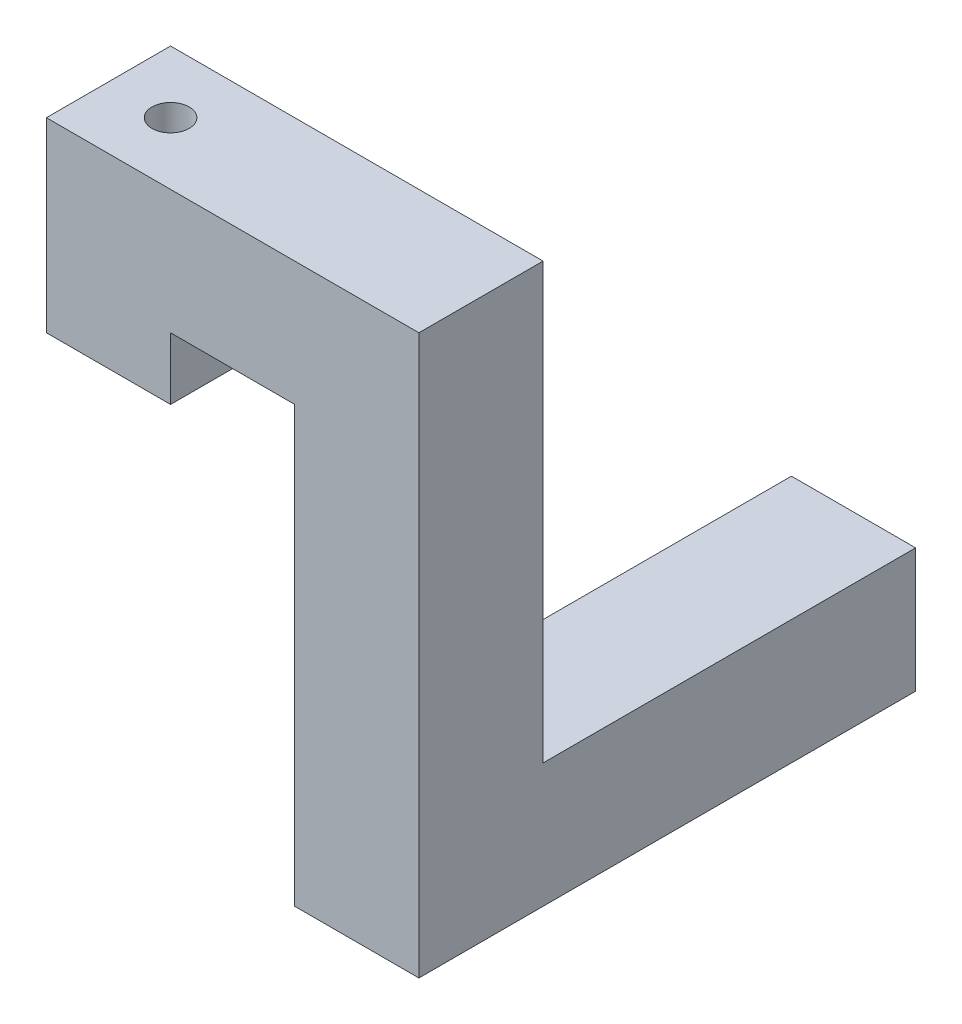
from build123d import *

# Parameters (mm, degrees)
SKETCH_1_W          = 20
SKETCH_1_H          = 20
EXTRUDE_1_DEPTH     = 30
SKETCH_2_W          = 20
SKETCH_2_H          = 20
EXTRUDE_2_DEPTH     = 40
SKETCH_6_W          = 20
SKETCH_6_H          = 20
EXTRUDE_3_DEPTH     = 70
SKETCH_7_W          = 20
SKETCH_7_H          = 20
EXTRUDE_4_DEPTH     = 60
SKETCH_8_R          = 3
CUT_EXTRUDE_1_DEPTH = 60


with BuildPart() as part:
    # 草图1 → 凸台-拉伸1 (new body)
    with BuildSketch(Plane(origin=(0, 0, 0), x_dir=(1, 0, 0), z_dir=(0, 1, 0))):
        Rectangle(SKETCH_1_W, SKETCH_1_H)
    extrude(amount=EXTRUDE_1_DEPTH)

    # 草图2 → 凸台-拉伸2 (add)
    with BuildSketch(Plane(origin=(10, 0, 0), x_dir=(0, 0, -1), z_dir=(1, 0, 0))):
        with Locations((0, 20)):
            Rectangle(SKETCH_2_W, SKETCH_2_H)
    extrude(amount=EXTRUDE_2_DEPTH)

    # 草图6 → 凸台-拉伸3 (add)
    with BuildSketch(Plane.XZ.offset(-10)):
        with Locations((40, 0)):
            Rectangle(SKETCH_6_W, SKETCH_6_H)
    extrude(amount=EXTRUDE_3_DEPTH)

    # 草图7 → 凸台-拉伸4 (add)
    with BuildSketch(Plane(origin=(0, 0, -10), x_dir=(-1, 0, 0), z_dir=(0, 0, -1))):
        with Locations((-40, -50)):
            Rectangle(SKETCH_7_W, SKETCH_7_H)
    extrude(amount=EXTRUDE_4_DEPTH)

    # 草图8 → 切除-拉伸1 (cut)
    with BuildSketch(Plane(origin=(0, 0, 0), x_dir=(-1, 0, 0), z_dir=(0, -1, 0))):
        with Locations(Location((0, 0, 0), (0, 0, 90))):
            Circle(SKETCH_8_R)
    extrude(amount=-CUT_EXTRUDE_1_DEPTH, mode=Mode.SUBTRACT)


solid = part.part
